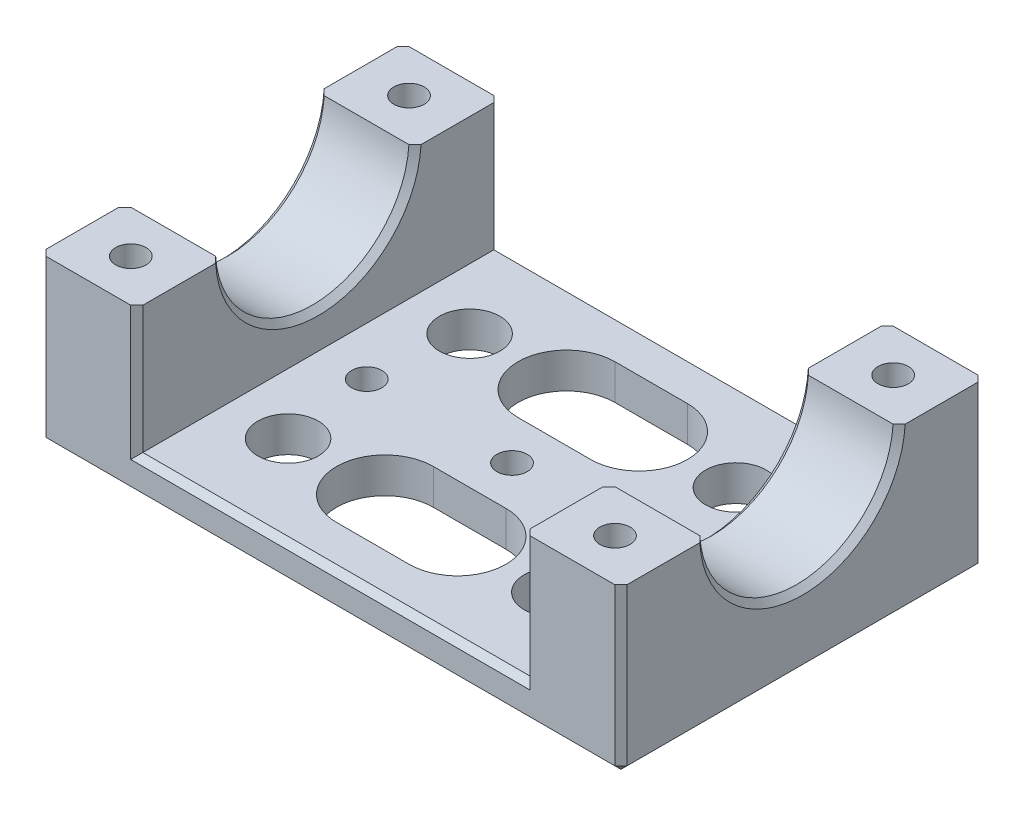
from build123d import *

# Parameters (mm, degrees)
SKETCH2_W                = 32
SKETCH2_H                = 30
BOSS_EXTRUDE1_DEPTH      = 2.922658801
BOSS_EXTRUDE2_DEPTH      = 25
BOSS_EXTRUDE2_DEPTH_BACK = 2.922659
SKETCH3_W                = 8
SKETCH3_H                = 30
CUT_EXTRUDE1_DEPTH       = 58.521082001
CUT_EXTRUDE1_DEPTH_BACK  = 58.521082001
SKETCH4_R                = 8
M3X0_5_TAPPED_HOLE1_D    = 2.5
SKETCH7_R                = 2.5
CUT_EXTRUDE2_DEPTH       = 38.762415177
SKETCH8_W                = 30
SKETCH8_H                = 18.9613294
CUT_EXTRUDE3_DEPTH       = 58.521082001
SKETCH9_W                = 30
SKETCH9_H                = 0.5
CUT_EXTRUDE4_DEPTH       = 53.19117472
M3X0_5_TAPPED_HOLE2_D    = 2.5
CHAMFER1_SIZE            = 0.5


with BuildPart() as part:
    # Sketch2 → Boss-Extrude1 (new body)
    with BuildSketch(Plane(origin=(0, 0, 0), x_dir=(1, 0, 0), z_dir=(0, 1, 0))):
        Rectangle(SKETCH2_W, SKETCH2_H)
    extrude(amount=BOSS_EXTRUDE1_DEPTH)

    # Sketch3 → Boss-Extrude2 (add, two sides: drawn at the far end of the back side and taken through both)
    with BuildSketch(Plane(origin=(0, 2.922658801, 0), x_dir=(1, 0, 0), z_dir=(0, 1, 0)).offset(-BOSS_EXTRUDE2_DEPTH_BACK)):
        with Locations((-20, 0)):
            Rectangle(SKETCH3_W, SKETCH3_H)
        with Locations((20, 0)):
            Rectangle(SKETCH3_W, SKETCH3_H)
    extrude(amount=BOSS_EXTRUDE2_DEPTH + BOSS_EXTRUDE2_DEPTH_BACK)

    # Sketch4 → Cut-Extrude1 (cut, two sides: drawn at the far end of the back side and taken through both)
    with BuildSketch(Plane(origin=(24, 0, 0), x_dir=(0, 0, -1), z_dir=(1, 0, 0)).offset(-CUT_EXTRUDE1_DEPTH_BACK)):
        with Locations((0, 13.961329401)):
            Circle(SKETCH4_R)
    extrude(amount=CUT_EXTRUDE1_DEPTH + CUT_EXTRUDE1_DEPTH_BACK, mode=Mode.SUBTRACT)

    # M3x0.5 Tapped Hole1 (through all)
    with Locations(Plane(origin=(0, 2.922658801, 0), x_dir=(1, 0, 0), z_dir=(0, 1, 0))):
        with Locations((12, 0), (0, 0), (-12, 0)):
            Hole(M3X0_5_TAPPED_HOLE1_D / 2)

    # Sketch7 → Cut-Extrude2 (cut, through all)
    with BuildSketch(Plane(origin=(0, 2.922658801, 0), x_dir=(1, 0, 0), z_dir=(0, 1, 0))):
        with Locations(Location((-11, 7.5, 0), (0, 0, 270))):
            Circle(SKETCH7_R)
        with Locations(Location((-11, -7.5, 0), (0, 0, 270))):
            Circle(SKETCH7_R)
        with Locations(Location((11, -7.5, 0), (0, 0, 270))):
            Circle(SKETCH7_R)
        with Locations(Location((11, 7.5, 0), (0, 0, 270))):
            Circle(SKETCH7_R)
        with BuildLine():
            Line((-3, 11.5), (3, 11.5))
            ThreePointArc((3, 11.5), (7, 7.5), (3, 3.5))
            Line((3, 3.5), (-3, 3.5))
            ThreePointArc((-3, 3.5), (-7, 7.5), (-3, 11.5))
        make_face()
        with BuildLine():
            Line((-3, -3.5), (3, -3.5))
            ThreePointArc((3, -3.5), (7, -7.5), (3, -11.5))
            Line((3, -11.5), (-3, -11.5))
            ThreePointArc((-3, -11.5), (-7, -7.5), (-3, -3.5))
        make_face()
    extrude(amount=-CUT_EXTRUDE2_DEPTH, mode=Mode.SUBTRACT)

    # Sketch8 → Cut-Extrude3 (cut, through all)
    with BuildSketch(Plane(origin=(24, 0, 0), x_dir=(0, 0, -1), z_dir=(1, 0, 0))):
        with Locations((0, 23.441994101)):
            Rectangle(SKETCH8_W, SKETCH8_H)
    extrude(amount=-CUT_EXTRUDE3_DEPTH, mode=Mode.SUBTRACT)

    # Sketch9 → Cut-Extrude4 (cut, through all)
    with BuildSketch(Plane(origin=(24, 0, 0), x_dir=(0, 0, -1), z_dir=(1, 0, 0))):
        with Locations((0, 13.711329401)):
            Rectangle(SKETCH9_W, SKETCH9_H)
    extrude(amount=-CUT_EXTRUDE4_DEPTH, mode=Mode.SUBTRACT)

    # M3x0.5 Tapped Hole2 (through all)
    with Locations(Plane(origin=(0, 13.461329401, 0), x_dir=(1, 0, 0), z_dir=(0, 1, 0))):
        with Locations((-20, 11.492179856), (20, -11.492179856), (20, 11.492179856), (-20, -11.492179856)):
            Hole(M3X0_5_TAPPED_HOLE2_D / 2)

    # Chamfer1
    chamfer1_edges = [part.edges().sort_by_distance(p)[0] for p in [
        (-16, 8.191994101, -15),
        (-16, 8.191994101, 15),
        (-24, 6.730664601, 15),
        (-24, 6.730664601, -15),
        (-24, -1.99e-07, 0),
        (-16, 5.961329401, 0),
        (-24, 5.961329401, 0),
        (24, 5.961329401, 0),
        (16, 5.961329401, 0),
        (0, 2.922658801, -15),
        (16, 8.191994101, 15),
        (16, 8.191994101, -15),
        (24, 6.730664601, -15),
        (24, 6.730664601, 15),
        (24, -1.99e-07, 0),
        (0, 0, -15),
        (0, 0, 15),
        (0, 2.922658801, 15),
    ]]
    chamfer(chamfer1_edges, length=CHAMFER1_SIZE)


solid = part.part
